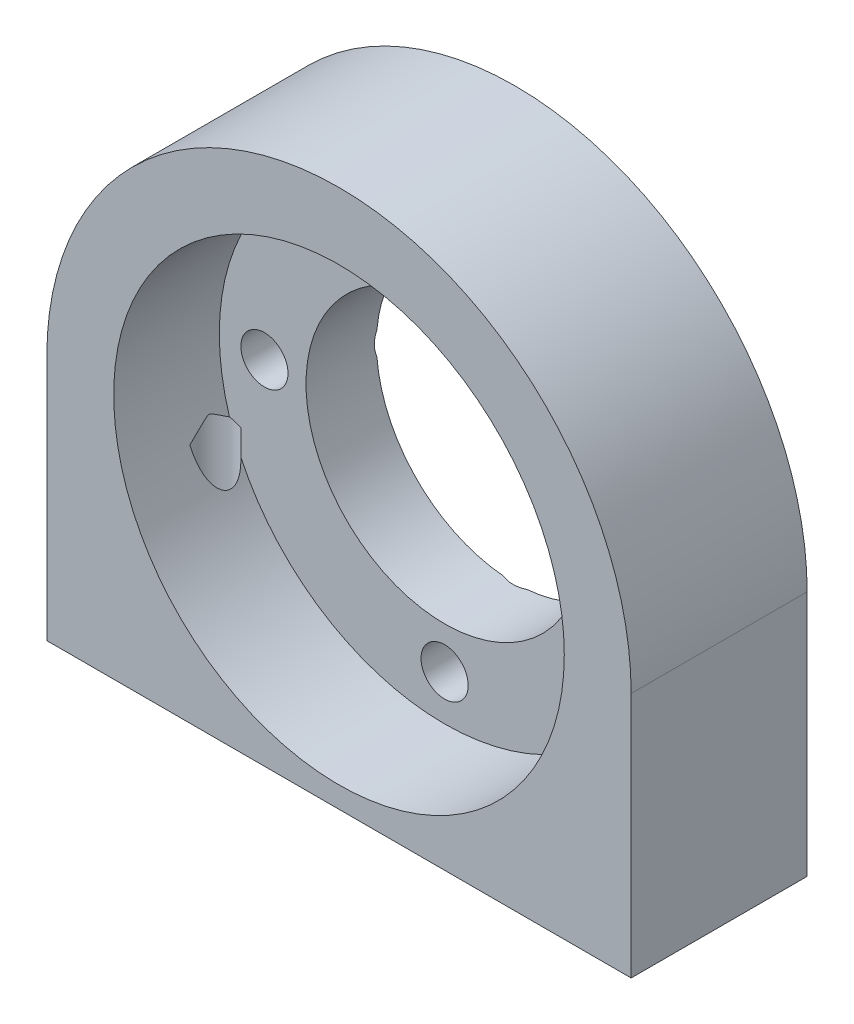
from build123d import *

# Parameters (mm, degrees)
BOSS_EXTRUDE1_DEPTH                             = 6.35
SKETCH2_R                                       = 16.256
CUT_EXTRUDE1_DEPTH                              = 7.62
SKETCH3_R                                       = 10
CUT_EXTRUDE2_DEPTH                              = 31.770069873
CSK_FOR_M3_FLAT_HEAD_MACHINE_SCREW1_D           = 3.4
CSK_FOR_M3_FLAT_HEAD_MACHINE_SCREW1_CSINK_D     = 6.3
CSK_FOR_M3_FLAT_HEAD_MACHINE_SCREW1_CSINK_ANGLE = 90
CIRPATTERN1_COUNT                               = 4
F_8_32_TAPPED_HOLE1_D                           = 3.4544
F_8_32_TAPPED_HOLE1_DEPTH                       = 12.7
F_8_32_TAPPED_HOLE1_TIP                         = 1.037806461


with BuildPart() as part:
    # Sketch1 → Boss-Extrude1 (new, symmetric)
    with BuildSketch(Plane.XY):
        with BuildLine():
            Line((-21.08, 0), (-21.08, -17.78))
            Line((-21.08, -17.78), (21.08, -17.78))
            Line((21.08, -17.78), (21.08, 0))
            ThreePointArc((21.08, 0), (0, 21.08), (-21.08, 0))
        make_face()
    extrude(amount=BOSS_EXTRUDE1_DEPTH, both=True)

    # Sketch2 → Cut-Extrude1 (cut)
    with BuildSketch(Plane.XY.offset(6.35)):
        Circle(SKETCH2_R)
    extrude(amount=-CUT_EXTRUDE1_DEPTH, mode=Mode.SUBTRACT)

    # Sketch3 → Cut-Extrude2 (cut, through all)
    with BuildSketch(Plane.XY.offset(-1.27)):
        Circle(SKETCH3_R)
    extrude(amount=-CUT_EXTRUDE2_DEPTH, mode=Mode.SUBTRACT)

    # CSK for M3 Flat Head Machine Screw1 (through all)
    with Locations(Plane(origin=(0, 0, -6.35), x_dir=(-1, 0, 0), z_dir=(0, 0, -1))):
        with Locations((0, 13)):
            csk_for_m3_flat_head_machine_screw1 = CounterSinkHole(CSK_FOR_M3_FLAT_HEAD_MACHINE_SCREW1_D / 2, CSK_FOR_M3_FLAT_HEAD_MACHINE_SCREW1_CSINK_D / 2, counter_sink_angle=CSK_FOR_M3_FLAT_HEAD_MACHINE_SCREW1_CSINK_ANGLE)

    # CirPattern1: CSK for M3 Flat Head Machine Screw1 ×4 about axis
    cirpattern1_axis = Axis((0, 0, 0), (0, 0, 1))
    for i in range(1, CIRPATTERN1_COUNT):
        add(csk_for_m3_flat_head_machine_screw1.rotate(cirpattern1_axis, i * 360 / CIRPATTERN1_COUNT), mode=Mode.SUBTRACT)

    # #8-32 Tapped Hole1
    with Locations(Plane.XZ.offset(17.78)):
        with Locations((15.875, 0), (-15.875, 0)):
            Hole(F_8_32_TAPPED_HOLE1_D / 2, depth=F_8_32_TAPPED_HOLE1_DEPTH)
            with Locations((0, 0, -(F_8_32_TAPPED_HOLE1_DEPTH + F_8_32_TAPPED_HOLE1_TIP / 2))):  # 118° drill point
                Cone(0, F_8_32_TAPPED_HOLE1_D / 2, F_8_32_TAPPED_HOLE1_TIP, mode=Mode.SUBTRACT)


solid = part.part
